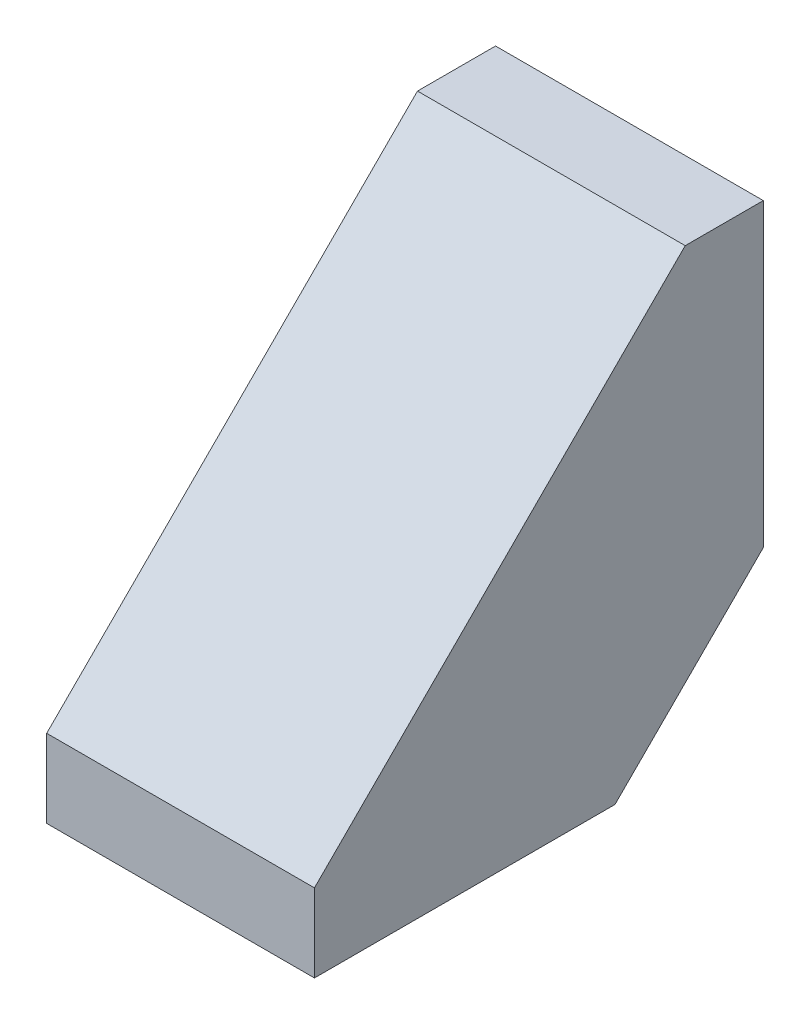
from build123d import *

# Parameters (mm, degrees)
BOSS_EXTRUDE1_DEPTH = 34.3


with BuildPart() as part:
    # Sketch1 → Boss-Extrude1 (new body)
    with BuildSketch(Plane(origin=(0, 0, 0), x_dir=(0, 0, -1), z_dir=(1, 0, 0))):
        Polygon((0, 0), (38.5, 0), (57.5, 19), (57.5, 57.5), (47.5, 57.5), (0, 10), align=None)
    extrude(amount=BOSS_EXTRUDE1_DEPTH)


solid = part.part
